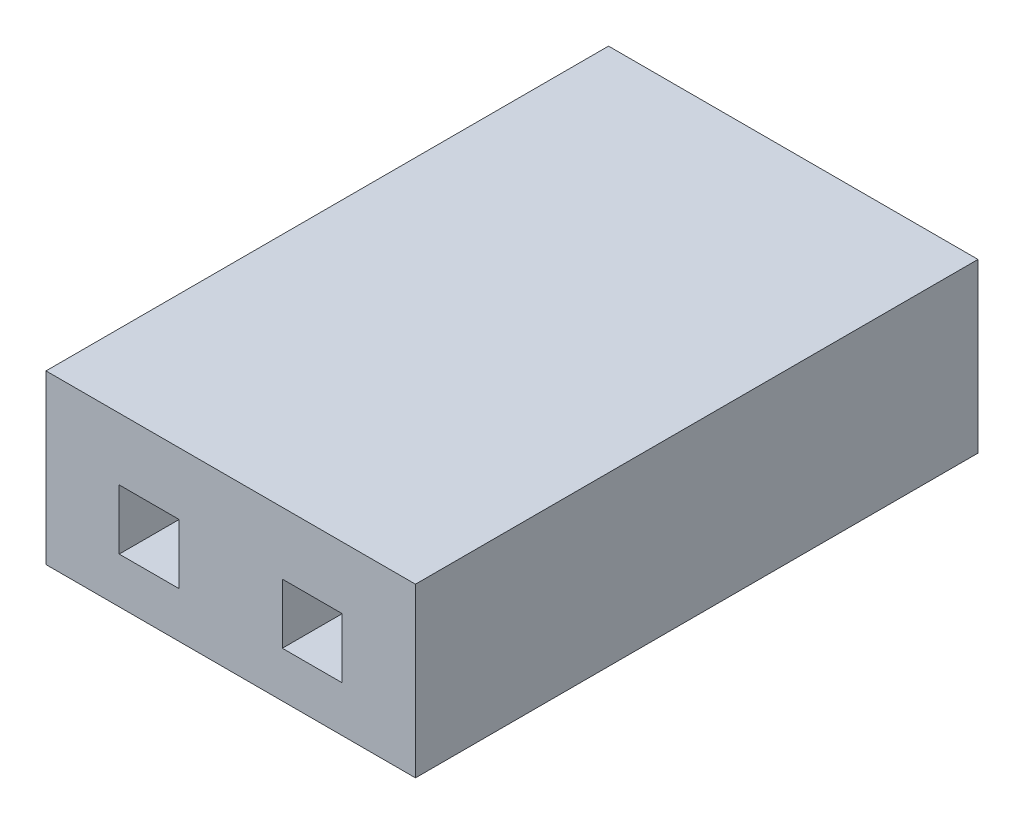
from build123d import *

# Parameters (mm, degrees)
SKICA1_W                 = 5.55
SKICA1_H                 = 2.52
P_IDAT_VYSUNUT_M1_DEPTH  = 8.45
SKICA2_W                 = 0.9
SKICA2_H                 = 0.9
ODEBRAT_VYSUNUT_M1_DEPTH = 7.43227342


with BuildPart() as part:
    # Skica1 → Přidat vysunutím1 (new body)
    with BuildSketch(Plane.XY):
        Rectangle(SKICA1_W, SKICA1_H)
    extrude(amount=P_IDAT_VYSUNUT_M1_DEPTH)

    # Skica2 → Odebrat vysunutím1 (cut)
    with BuildSketch(Plane.XY.offset(8.45)):
        with Locations((1.225, -0.123399364)):
            Rectangle(SKICA2_W, SKICA2_H)
        with Locations((-1.225, -0.123399364)):
            Rectangle(SKICA2_W, SKICA2_H)
    extrude(amount=-ODEBRAT_VYSUNUT_M1_DEPTH, mode=Mode.SUBTRACT)


solid = part.part
